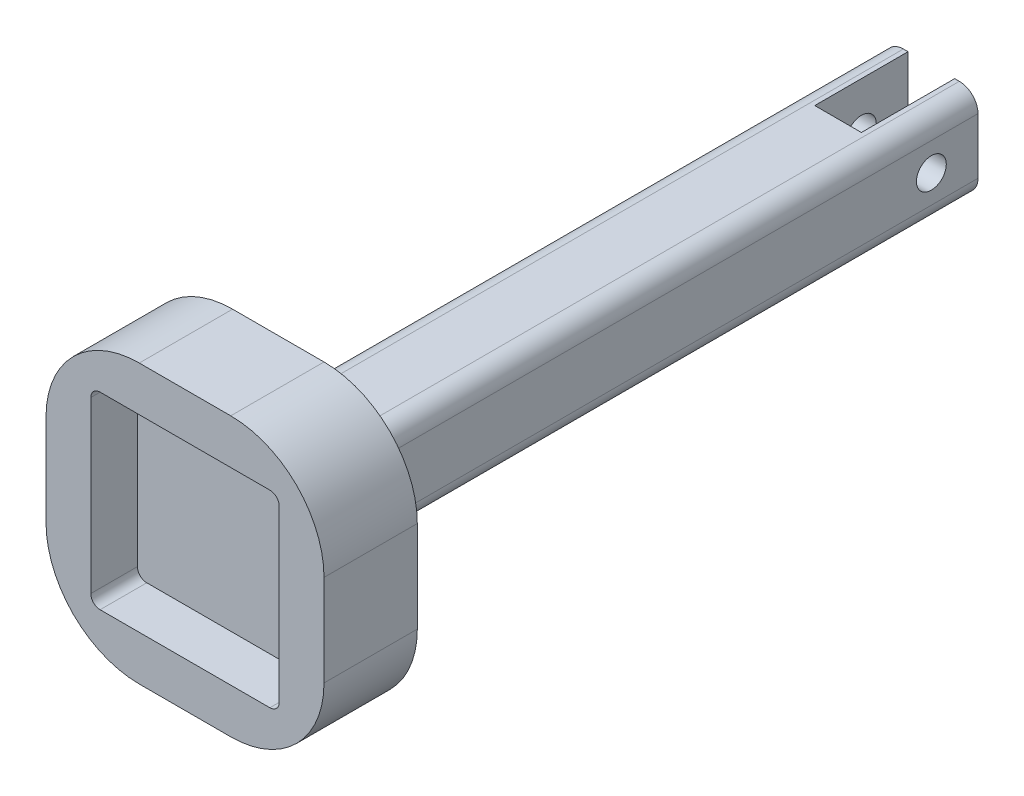
from build123d import *

# Parameters (mm, degrees)
SKETCH_1_W          = 29.8
SKETCH_1_H          = 29.8
EXTRUDE_1_DEPTH     = 10
FILLET_1_R          = 10
SKETCH_2_W          = 10
SKETCH_2_H          = 10
EXTRUDE_2_DEPTH     = 70
SKETCH_3_W          = 5
SKETCH_3_H          = 10
CUT_EXTRUDE_1_DEPTH = 75.283376337
SKETCH_4_R          = 1.6
CUT_EXTRUDE_2_DEPTH = 75.283376337
CUT_EXTRUDE_3_DEPTH = 5
FILLET_3_R          = 2


with BuildPart() as part:
    # ｽｹｯﾁ1 → ﾎﾞｽ - 押し出し1 (new body)
    with BuildSketch(Plane.XY):
        Rectangle(SKETCH_1_W, SKETCH_1_H)
    extrude(amount=EXTRUDE_1_DEPTH)

    # ﾌｨﾚｯﾄ1
    fillet_1_edges = [part.edges().sort_by_distance(p)[0] for p in [
        (-14.9, -14.9, 5),
        (14.9, -14.9, 5),
        (14.9, 14.9, 5),
        (-14.9, 14.9, 5),
    ]]
    fillet(fillet_1_edges, radius=FILLET_1_R)

    # ｽｹｯﾁ2 → ﾎﾞｽ - 押し出し2 (add)
    with BuildSketch(Plane(origin=(0, 0, 0), x_dir=(-1, 0, 0), z_dir=(0, 0, -1))):
        Rectangle(SKETCH_2_W, SKETCH_2_H)
    extrude(amount=EXTRUDE_2_DEPTH)

    # ｽｹｯﾁ3 → ｶｯﾄ - 押し出し1 (cut, through all)
    with BuildSketch(Plane(origin=(0, 5, 0), x_dir=(1, 0, 0), z_dir=(0, 1, 0))):
        with Locations((0, 65)):
            Rectangle(SKETCH_3_W, SKETCH_3_H)
    extrude(amount=-CUT_EXTRUDE_1_DEPTH, mode=Mode.SUBTRACT)

    # ｽｹｯﾁ4 → ｶｯﾄ - 押し出し2 (cut, through all)
    with BuildSketch(Plane(origin=(5, 0, 0), x_dir=(0, 0, -1), z_dir=(1, 0, 0))):
        with Locations((65, 0)):
            Circle(SKETCH_4_R)
    extrude(amount=-CUT_EXTRUDE_2_DEPTH, mode=Mode.SUBTRACT)

    # ｽｹｯﾁ5 → ｶｯﾄ - 押し出し3 (cut)
    with BuildSketch(Plane.XY.offset(10)):
        with BuildLine():
            Line((-9.1, -10.1), (9.1, -10.1))
            ThreePointArc((9.1, -10.1), (9.807106781, -9.807106781), (10.1, -9.1))
            Line((10.1, -9.1), (10.1, 9.1))
            ThreePointArc((10.1, 9.1), (9.807106781, 9.807106781), (9.1, 10.1))
            Line((9.1, 10.1), (-9.1, 10.1))
            ThreePointArc((-9.1, 10.1), (-9.807106781, 9.807106781), (-10.1, 9.1))
            Line((-10.1, 9.1), (-10.1, -9.1))
            ThreePointArc((-10.1, -9.1), (-9.807106781, -9.807106781), (-9.1, -10.1))
        make_face()
    extrude(amount=-CUT_EXTRUDE_3_DEPTH, mode=Mode.SUBTRACT)

    # ﾌｨﾚｯﾄ3
    fillet_3_edges = [part.edges().sort_by_distance(p)[0] for p in [
        (-5, -5, -35),
        (-5, 5, -35),
        (5, 5, -35),
        (5, -5, -35),
    ]]
    fillet(fillet_3_edges, radius=FILLET_3_R)


solid = part.part
